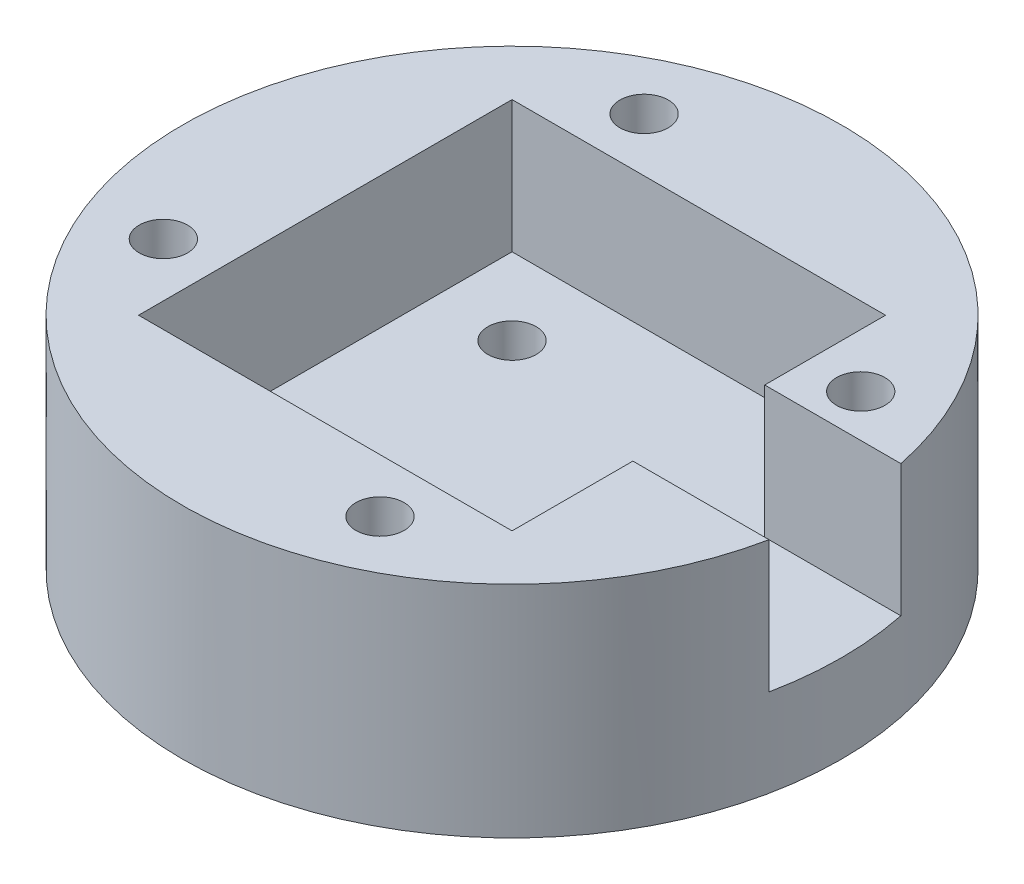
from build123d import *

# Parameters (mm, degrees)
SKETCH1_R                   = 15
BOSS_EXTRUDE1_DEPTH         = 10
ACCEL_START                 = 4
SKETCH1_3_R                 = 1.1
ACCEL_CUTOUT_DEPTH          = 6
SKETCH1_4_R                 = 1.1
ACCEL_MOUNT_HOLES_DEPTH     = 24.452078799
SKETCH2_R                   = 5
REAR_THREAD_INSERT_DEPTH    = 3
SKETCH1_5_R                 = 1.1
LAYERSCREW_HOLES_DEPTH      = 24.452078799
LAYERSCREW_HOLES_MORE_COUNT = 4


with BuildPart() as part:
    # Sketch1 → Boss-Extrude1 (new body)
    with BuildSketch(Plane(origin=(0, 0, 0), x_dir=(1, 0, 0), z_dir=(0, 1, 0))):
        Circle(SKETCH1_R)
    extrude(amount=BOSS_EXTRUDE1_DEPTH)

    # Sketch1<3> → accel cutout (cut)
    with BuildSketch(Plane(origin=(0, 0, 0), x_dir=(1, 0, 0), z_dir=(0, 1, 0)).offset(ACCEL_START)):
        with BuildLine():
            Line((-8.5, 8.5), (-8.5, -8.5))
            Line((-8.5, -8.5), (8.5, -8.5))
            Line((8.5, -8.5), (8.5, -3))
            Line((8.5, -3), (14.696938457, -3))
            ThreePointArc((14.696938457, -3), (15, 0), (14.696938457, 3))
            Line((14.696938457, 3), (8.5, 3))
            Line((8.5, 3), (8.5, 8.5))
            Line((8.5, 8.5), (-8.5, 8.5))
        make_face()
        with Locations((-5, 5)):
            Circle(SKETCH1_3_R, mode=Mode.SUBTRACT)
        with Locations((-5, -5)):
            Circle(SKETCH1_3_R, mode=Mode.SUBTRACT)
    extrude(amount=ACCEL_CUTOUT_DEPTH, mode=Mode.SUBTRACT)

    # Sketch1<4> → accel mount holes (cut, through all)
    with BuildSketch(Plane(origin=(0, 0, 0), x_dir=(1, 0, 0), z_dir=(0, 1, 0))):
        with Locations((-5, 5)):
            Circle(SKETCH1_4_R)
        with Locations((-5, -5)):
            Circle(SKETCH1_4_R)
    extrude(amount=ACCEL_MOUNT_HOLES_DEPTH, mode=Mode.SUBTRACT)

    # Sketch2 → rear thread insert (cut)
    with BuildSketch(Plane(origin=(0, 0, 0), x_dir=(1, 0, 0), z_dir=(0, 1, 0))):
        Circle(SKETCH2_R)
    extrude(amount=REAR_THREAD_INSERT_DEPTH, mode=Mode.SUBTRACT)

    # Sketch1<5> → layerscrew holes (cut, through all)
    with BuildSketch(Plane(origin=(0, 0, 0), x_dir=(1, 0, 0), z_dir=(0, 1, 0))):
        with Locations((10.940488944, 4.930081304)):
            Circle(SKETCH1_5_R)
    layerscrew_holes = extrude(amount=LAYERSCREW_HOLES_DEPTH, mode=Mode.SUBTRACT)

    # layerscrew holes more: layerscrew holes ×4 about axis
    layerscrew_holes_more_axis = Axis((0, 10, 0), (0, -1, 0))
    for i in range(1, LAYERSCREW_HOLES_MORE_COUNT):
        add(layerscrew_holes.rotate(layerscrew_holes_more_axis, i * 360 / LAYERSCREW_HOLES_MORE_COUNT), mode=Mode.SUBTRACT)


solid = part.part
